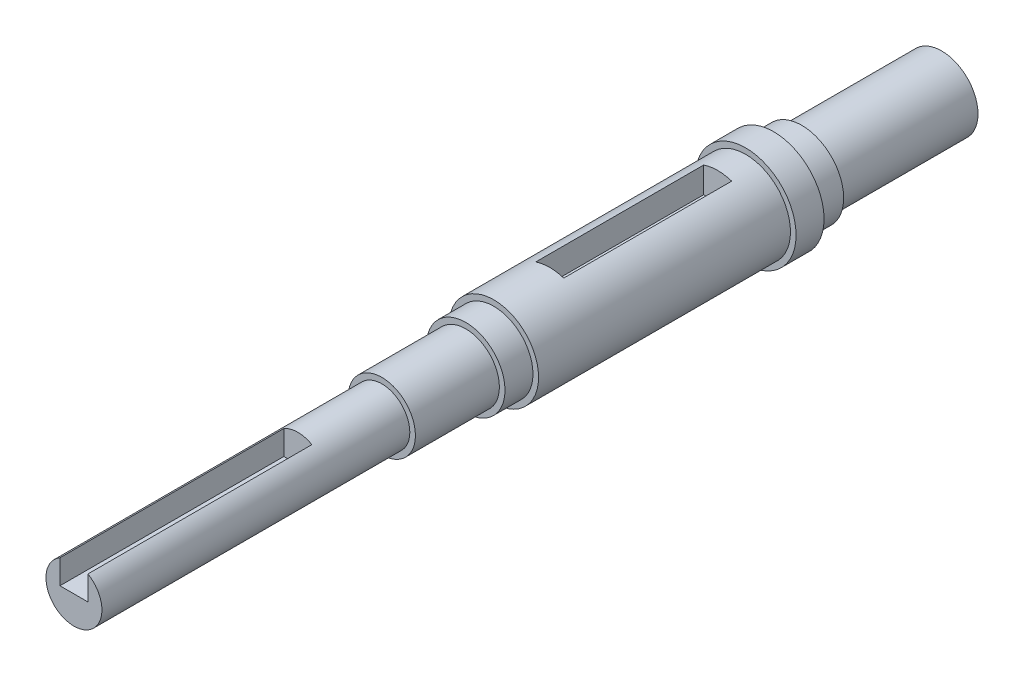
from build123d import *

# Parameters (mm, degrees)
SKETCH2_W          = 6.35
SKETCH2_H          = 50.8
CUT_EXTRUDE1_DEPTH = 6.35
SKETCH3_W          = 6.35
SKETCH3_H          = 38.1
CUT_EXTRUDE3_DEPTH = 6.35


with BuildPart() as part:
    # Sketch1 → Revolve1 (revolve)
    with BuildSketch(Plane(origin=(0, 0, 0), x_dir=(0, 0, -1), z_dir=(1, 0, 0)), mode=Mode.PRIVATE) as revolve1_sk:
        Polygon((0, 0), (0, 6.35), (69.85, 6.35), (69.85, 7.62), (88.9, 7.62), (88.9, 8.89), (95.25, 8.89), (95.25, 10.16), (152.4, 10.16), (152.4, 11.43), (158.75, 11.43), (158.75, 9.525), (165.1, 9.525), (165.1, 8.255), (196.85, 8.255), (196.85, 0), align=None)
    revolve(revolve1_sk.sketch.rotate(Axis((0, 0, 0), (0, 0, -1)), 90), axis=Axis((0, 0, 0), (0, 0, -1)))

    # Sketch2 → Cut-Extrude1 (cut)
    with BuildSketch(Plane(origin=(0, 6.35, 0), x_dir=(1, 0, 0), z_dir=(0, 1, 0))):
        with Locations((0, 25.4)):
            Rectangle(SKETCH2_W, SKETCH2_H)
    extrude(amount=-CUT_EXTRUDE1_DEPTH, mode=Mode.SUBTRACT)

    # Sketch3 → Cut-Extrude3 (cut)
    with BuildSketch(Plane(origin=(0, 10.16, 0), x_dir=(1, 0, 0), z_dir=(0, 1, 0))):
        with Locations((0, 127)):
            Rectangle(SKETCH3_W, SKETCH3_H)
    extrude(amount=-CUT_EXTRUDE3_DEPTH, mode=Mode.SUBTRACT)


solid = part.part
